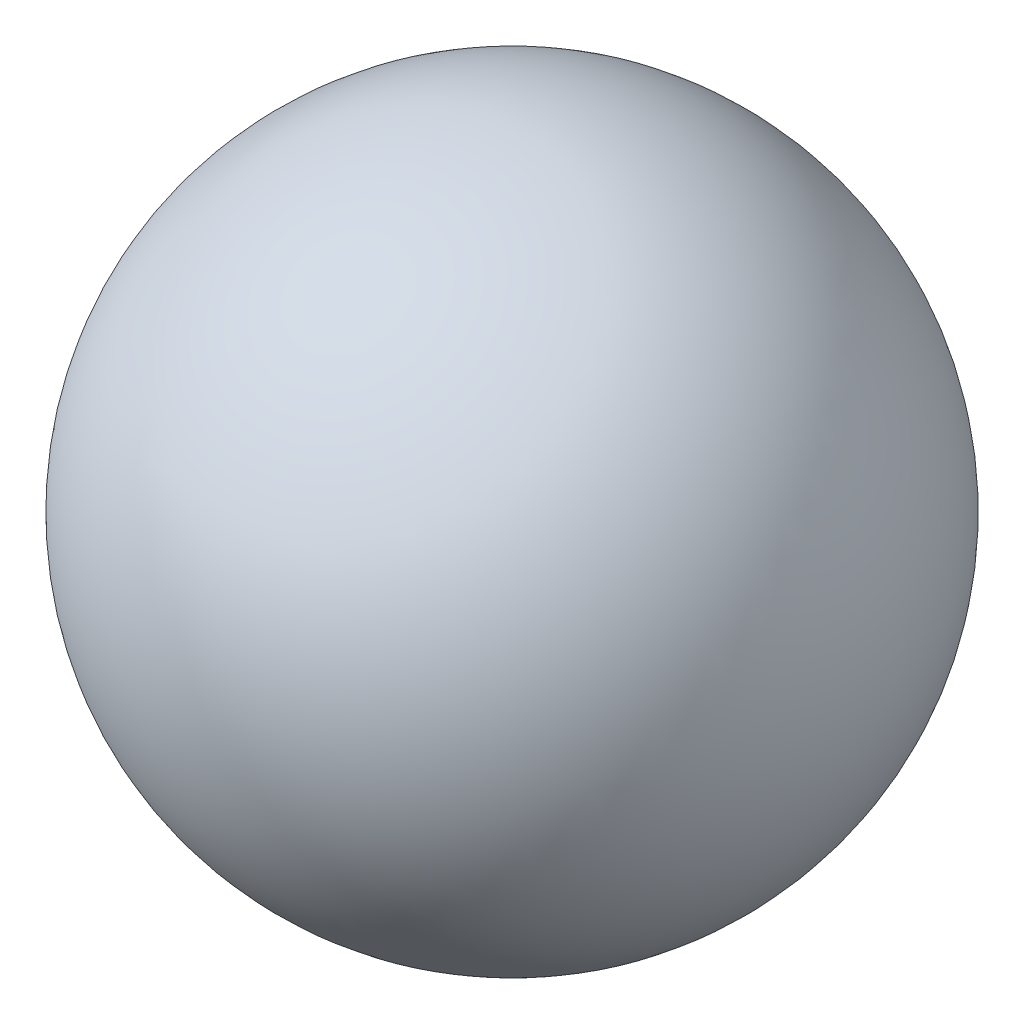
from build123d import *


with BuildPart() as part:
    # Sketch1 → Revolve5 (revolve)
    with BuildSketch(Plane.XY):
        with BuildLine():
            Line((0, 28.56), (0, -28.56))
            ThreePointArc((0, -28.56), (-28.56, 0), (0, 28.56))
        make_face()
    revolve(axis=Axis((0, 28.56, 0), (0, -1, 0)))


solid = part.part
